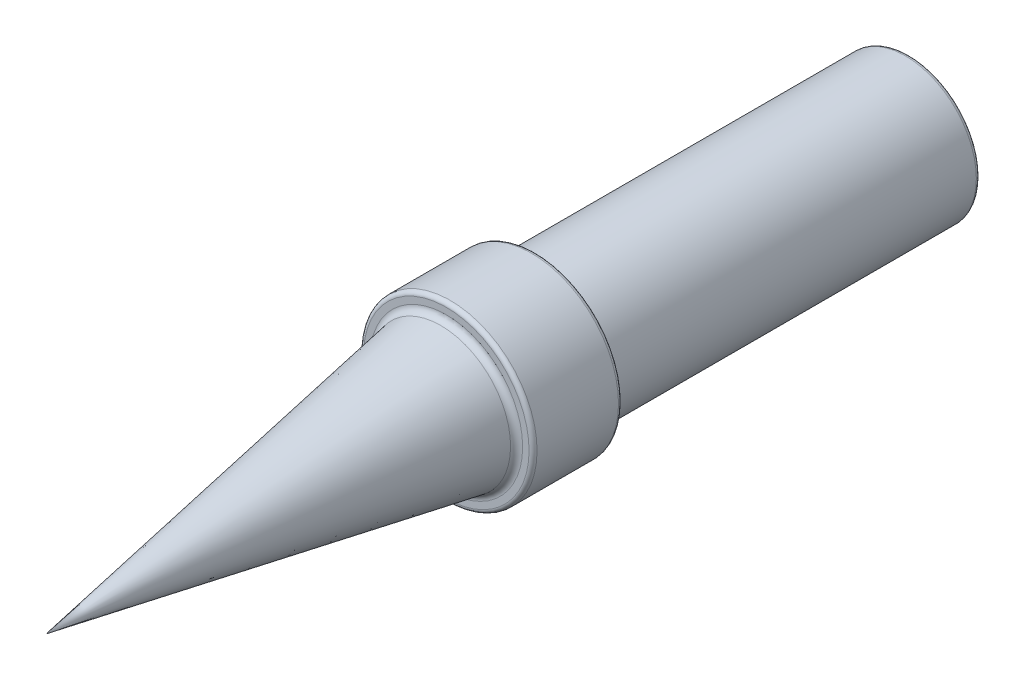
from build123d import *

# Parameters (mm, degrees)
ESQUISSE1_R             = 2.65
BOSS_EXTRU_1_DEPTH      = 14
ESQUISSE2_R             = 3.25
BOSS_EXTRU_2_DEPTH      = 3.35
CONG_1_R                = 0.25
CONG_2_R                = 0.15
ESQUISSE4_R             = 2.258133723
ENL_V_MAT_EXTRU_1_DEPTH = 14
CONG_3_R                = 0.15


with BuildPart() as part:
    # Esquisse1 → Boss.-Extru.1 (new body)
    with BuildSketch(Plane.XY):
        Circle(ESQUISSE1_R)
    extrude(amount=BOSS_EXTRU_1_DEPTH)

    # Esquisse2 → Boss.-Extru.2 (add)
    with BuildSketch(Plane.XY.offset(14)):
        Circle(ESQUISSE2_R)
    extrude(amount=BOSS_EXTRU_2_DEPTH)

    # Esquisse3 → Révolution1 (revolve)
    with BuildSketch(Plane(origin=(0, 0, 0), x_dir=(1, 0, 0), z_dir=(0, 1, 0))):
        Polygon((0, -32.340173819), (-2.65, -17.35), (0, -17.35), align=None)
    revolve(axis=Axis((0, 0, 17.35), (0, 0, 1)))

    # Congé1
    cong_1_edges = [part.edges().sort_by_distance(p)[0] for p in [
        (-2.65, 0, 14),
        (2.65, 0, 17.35),
    ]]
    fillet(cong_1_edges, radius=CONG_1_R)

    # Congé2
    cong_2_edges = [part.edges().sort_by_distance(p)[0] for p in [
        (-3.25, 0, 14),
        (-3.25, 0, 17.35),
    ]]
    fillet(cong_2_edges, radius=CONG_2_R)

    # Esquisse4 → Enlèv. mat.-Extru.1 (cut)
    with BuildSketch(Plane(origin=(0, 0, 0), x_dir=(-1, 0, 0), z_dir=(0, 0, -1))):
        Circle(ESQUISSE4_R)
    extrude(amount=-ENL_V_MAT_EXTRU_1_DEPTH, mode=Mode.SUBTRACT)

    # Congé3
    cong_3_edges = [part.edges().sort_by_distance(p)[0] for p in [
        (-2.65, 0, 0),
        (2.258133723, 0, 0),
    ]]
    fillet(cong_3_edges, radius=CONG_3_R)


solid = part.part
